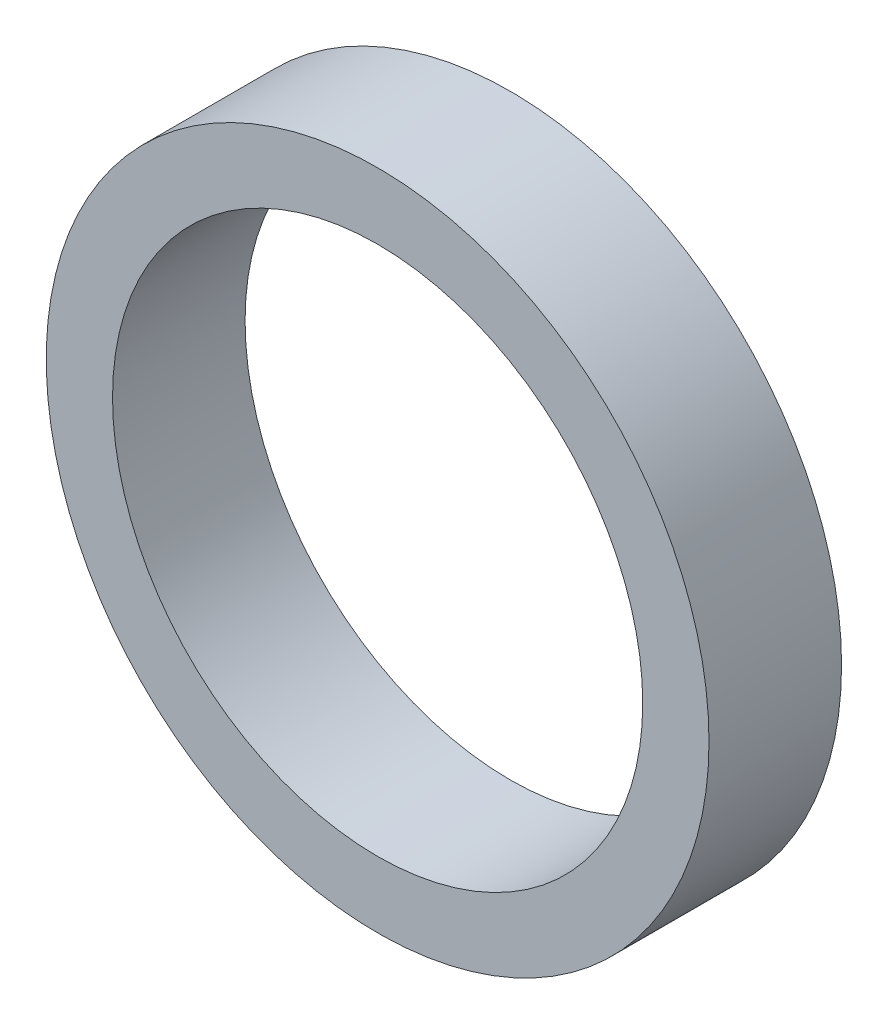
from build123d import *

# Parameters (mm, degrees)
SKETCH1_R           = 12.5
SKETCH1_R_2         = 10
BOSS_EXTRUDE1_DEPTH = 2.5


with BuildPart() as part:
    # Sketch1 → Boss-Extrude1 (new, symmetric)
    with BuildSketch(Plane.XY):
        Circle(SKETCH1_R)
        Circle(SKETCH1_R_2, mode=Mode.SUBTRACT)
    extrude(amount=BOSS_EXTRUDE1_DEPTH, both=True)


solid = part.part
